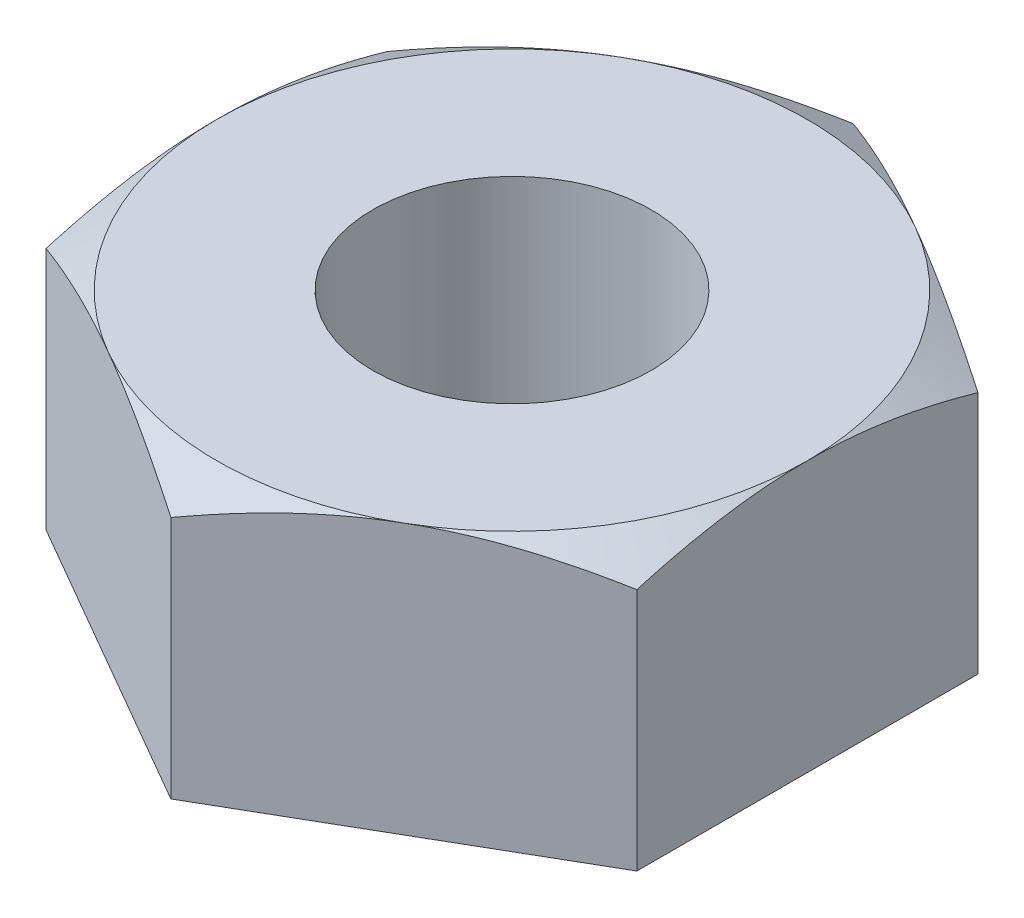
from build123d import *

# Parameters (mm, degrees)
BOSS_EXTRUDE1_DEPTH = 3.2
TAPPED_HOLE1_D      = 3.3


with BuildPart() as part:
    # Sketch1 → Boss-Extrude1 (new body)
    with BuildSketch(Plane(origin=(0, 0, 0), x_dir=(1, 0, 0), z_dir=(0, 1, 0))):
        Polygon((0, 4.041451884), (-3.5, 2.020725942), (-3.5, -2.020725942), (0, -4.041451884), (3.5, -2.020725942), (3.5, 2.020725942), align=None)
    extrude(amount=-BOSS_EXTRUDE1_DEPTH)

    # Sketch2 → Cut-Revolve1 (revolve, cut)
    with BuildSketch(Plane(origin=(0, 0, 0), x_dir=(0, 0, -1), z_dir=(1, 0, 0))):
        Polygon((3.5, 0), (4.041451884, 0), (4.041451884, -0.312607391), align=None)
    revolve(axis=Axis((0, 0, 0), (0, -1, 0)), mode=Mode.SUBTRACT)

    # Tapped Hole1 (through all)
    with Locations(Plane(origin=(0, 0, 0), x_dir=(1, 0, 0), z_dir=(0, 1, 0))):
        with Locations((0, 0)):
            Hole(TAPPED_HOLE1_D / 2)


solid = part.part
